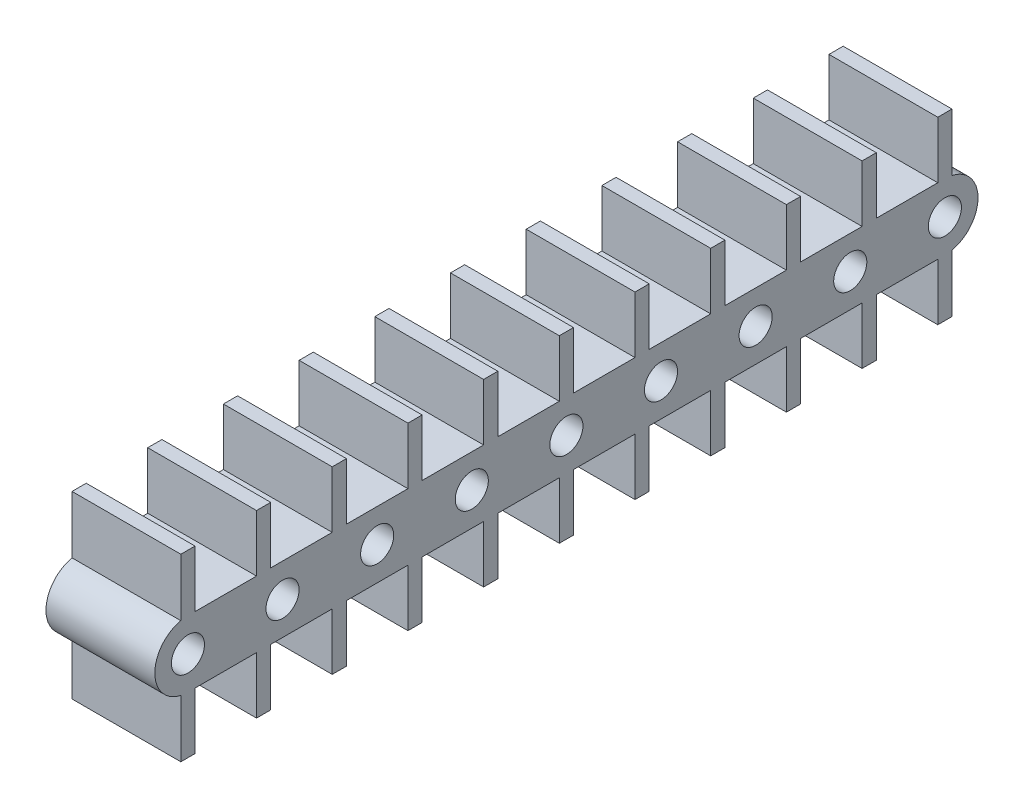
from build123d import *

# Parameters (mm, degrees)
SKETCH1_R           = 17.5
BOSS_EXTRUDE1_DEPTH = 115


with BuildPart() as part:
    # Sketch1 → Boss-Extrude1 (new body)
    with BuildSketch(Plane(origin=(0, 0, 0), x_dir=(0, 0, -1), z_dir=(1, 0, 0))):
        with BuildLine():
            Line((7.5, 35), (72.5, 35))
            Line((72.5, 35), (72.5, 95))
            Line((72.5, 95), (87.5, 95))
            Line((87.5, 95), (87.5, 35))
            Line((87.5, 35), (152.5, 35))
            Line((152.5, 35), (152.5, 95))
            Line((152.5, 95), (167.5, 95))
            Line((167.5, 95), (167.5, 35))
            Line((167.5, 35), (232.5, 35))
            Line((232.5, 35), (232.5, 95))
            Line((232.5, 95), (247.5, 95))
            Line((247.5, 95), (247.5, 35))
            Line((247.5, 35), (312.5, 35))
            Line((312.5, 35), (312.5, 95))
            Line((312.5, 95), (327.5, 95))
            Line((327.5, 95), (327.5, 35))
            Line((327.5, 35), (392.5, 35))
            Line((392.5, 35), (392.5, 95))
            Line((392.5, 95), (407.5, 95))
            Line((407.5, 95), (407.5, 35))
            Line((407.5, 35), (472.5, 35))
            Line((472.5, 35), (472.5, 95))
            Line((472.5, 95), (487.5, 95))
            Line((487.5, 95), (487.5, 35))
            Line((487.5, 35), (552.5, 35))
            Line((552.5, 35), (552.5, 95))
            Line((552.5, 95), (567.5, 95))
            Line((567.5, 95), (567.5, 35))
            Line((567.5, 35), (632.5, 35))
            Line((632.5, 35), (632.5, 95))
            Line((632.5, 95), (647.5, 95))
            Line((647.5, 95), (647.5, 35))
            Line((647.5, 35), (712.5, 35))
            Line((712.5, 35), (712.5, 95))
            Line((712.5, 95), (727.5, 95))
            Line((727.5, 95), (727.5, 35))
            Line((727.5, 35), (792.5, 35))
            Line((792.5, 35), (792.5, 95))
            Line((792.5, 95), (807.5, 95))
            Line((807.5, 95), (807.5, 34.186985828))
            ThreePointArc((807.5, 34.186985828), (835, 0), (807.5, -34.186985828))
            Line((807.5, -34.186985828), (807.5, -95))
            Line((807.5, -95), (792.5, -95))
            Line((792.5, -95), (792.5, -35))
            Line((792.5, -35), (727.5, -35))
            Line((727.5, -35), (727.5, -95))
            Line((727.5, -95), (712.5, -95))
            Line((712.5, -95), (712.5, -35))
            Line((712.5, -35), (647.5, -35))
            Line((647.5, -35), (647.5, -95))
            Line((647.5, -95), (632.5, -95))
            Line((632.5, -95), (632.5, -35))
            Line((632.5, -35), (567.5, -35))
            Line((567.5, -35), (567.5, -95))
            Line((567.5, -95), (552.5, -95))
            Line((552.5, -95), (552.5, -35))
            Line((552.5, -35), (487.5, -35))
            Line((487.5, -35), (487.5, -95))
            Line((487.5, -95), (472.5, -95))
            Line((472.5, -95), (472.5, -35))
            Line((472.5, -35), (407.5, -35))
            Line((407.5, -35), (407.5, -95))
            Line((407.5, -95), (392.5, -95))
            Line((392.5, -95), (392.5, -35))
            Line((392.5, -35), (327.5, -35))
            Line((327.5, -35), (327.5, -95))
            Line((327.5, -95), (312.5, -95))
            Line((312.5, -95), (312.5, -35))
            Line((312.5, -35), (247.5, -35))
            Line((247.5, -35), (247.5, -95))
            Line((247.5, -95), (232.5, -95))
            Line((232.5, -95), (232.5, -35))
            Line((232.5, -35), (167.5, -35))
            Line((167.5, -35), (167.5, -95))
            Line((167.5, -95), (152.5, -95))
            Line((152.5, -95), (152.5, -35))
            Line((152.5, -35), (87.5, -35))
            Line((87.5, -35), (87.5, -95))
            Line((87.5, -95), (72.5, -95))
            Line((72.5, -95), (72.5, -35))
            Line((72.5, -35), (7.5, -35))
            Line((7.5, -35), (7.5, -95))
            Line((7.5, -95), (-7.5, -95))
            Line((-7.5, -95), (-7.5, -34.186985828))
            ThreePointArc((-7.5, -34.186985828), (-35, 0), (-7.5, 34.186985828))
            Line((-7.5, 34.186985828), (-7.5, 95))
            Line((-7.5, 95), (7.5, 95))
            Line((7.5, 95), (7.5, 35))
        make_face()
        Circle(SKETCH1_R, mode=Mode.SUBTRACT)
        with Locations((800, 0)):
            Circle(SKETCH1_R, mode=Mode.SUBTRACT)
        with Locations((100, 0)):
            Circle(SKETCH1_R, mode=Mode.SUBTRACT)
        with Locations((200, 0)):
            Circle(SKETCH1_R, mode=Mode.SUBTRACT)
        with Locations((300, 0)):
            Circle(SKETCH1_R, mode=Mode.SUBTRACT)
        with Locations((400, 0)):
            Circle(SKETCH1_R, mode=Mode.SUBTRACT)
        with Locations((500, 0)):
            Circle(SKETCH1_R, mode=Mode.SUBTRACT)
        with Locations((600, 0)):
            Circle(SKETCH1_R, mode=Mode.SUBTRACT)
        with Locations((700, 0)):
            Circle(SKETCH1_R, mode=Mode.SUBTRACT)
    extrude(amount=BOSS_EXTRUDE1_DEPTH)


solid = part.part
